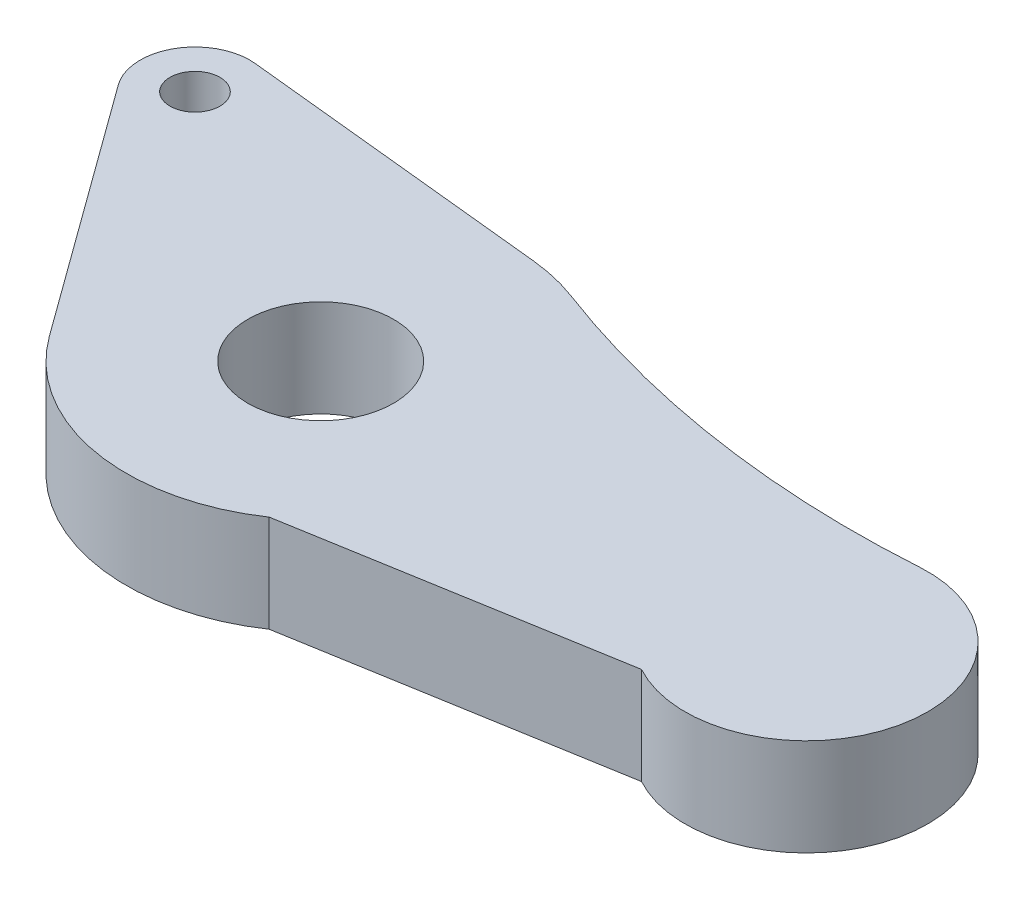
from build123d import *

# Parameters (mm, degrees)
SKETCH1_R           = 1.5
BOSS_EXTRUDE1_DEPTH = 2
BOSS_EXTRUDE2_START = -2
SKETCH2_R           = 0.514521653
BOSS_EXTRUDE2_DEPTH = 2


with BuildPart() as part:
    # Sketch1 → Boss-Extrude1 (new body)
    with BuildSketch(Plane(origin=(0, 0, 0), x_dir=(1, 0, 0), z_dir=(0, 1, 0))):
        with BuildLine():
            Line((2.247922133, -3.308601832), (8.796170176, -2.191071372))
            ThreePointArc((8.796170176, -2.191071372), (12.441065174, -0.53963026), (9.831944444, 2.49434507))
            ThreePointArc((9.831944444, 2.49434507), (5.556167823, 2.665089568), (1.414583333, 3.741517606))
            ThreePointArc((1.414583333, 3.741517606), (-3.972345981, -0.469539568), (2.247922133, -3.308601832))
        make_face()
        with Locations(Location((0, 0, 0), (0, 0, 270))):
            Circle(SKETCH1_R, mode=Mode.SUBTRACT)
    extrude(amount=BOSS_EXTRUDE1_DEPTH)

    # Sketch2 → Boss-Extrude2 (add)
    with BuildSketch(Plane(origin=(0, 2, 0), x_dir=(1, 0, 0), z_dir=(0, 1, 0)).offset(BOSS_EXTRUDE2_START)):
        with BuildLine():
            Line((-5.984144072, 4.635311674), (0.408466301, 3.979089755))
            ThreePointArc((0.408466301, 3.979089755), (-3.466544022, 1.995763648), (-3.236020649, -2.35120615))
            Line((-3.236020649, -2.35120615), (-7.013353091, 2.847625854))
            ThreePointArc((-7.013353091, 2.847625854), (-7.078453265, 4.075217168), (-5.984144072, 4.635311674))
        make_face()
        with Locations(Location((-6.099495617, 3.51161028, 0), (0, 0, 270))):
            Circle(SKETCH2_R, mode=Mode.SUBTRACT)
    extrude(amount=BOSS_EXTRUDE2_DEPTH)


solid = part.part
